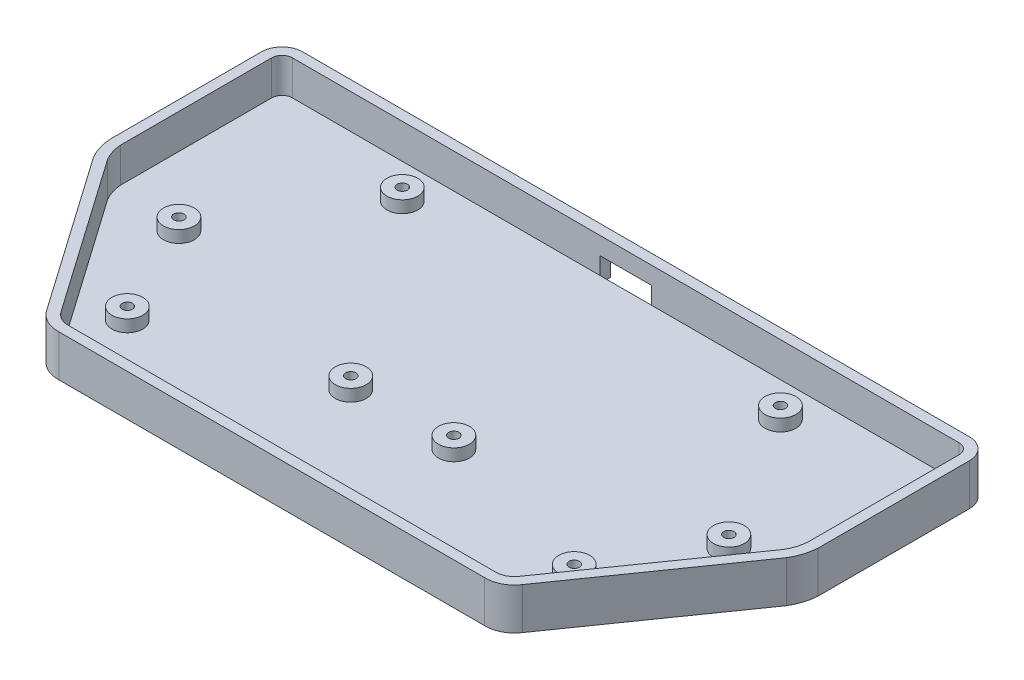
from build123d import *

# Parameters (mm, degrees)
EXTRUDE_1_DEPTH     = 2
EXTRUDE_START       = 10.1
EXTRUDE_2_DEPTH     = 10.1
SKETCH_3_R          = 1.5
CUT_EXTRUDE_1_DEPTH = 228.860936532
EXTRUDE_START_2     = 3.5
SKETCH_6_R          = 4.5
SKETCH_6_R_2        = 1.5
EXTRUDE_3_DEPTH     = 3.5
SKETCH_7_W          = 15
SKETCH_7_H          = 7
CUT_EXTRUDE_2_DEPTH = 3


with BuildPart() as part:
    # 草图1 → 凸台-拉伸1 (new body)
    with BuildSketch(Plane(origin=(0, 0, 0), x_dir=(1, 0, 0), z_dir=(0, 1, 0))):
        with BuildLine():
            Line((197, 3), (3, 3))
            ThreePointArc((3, 3), (-1.242640687, 1.242640687), (-3, -3))
            Line((-3, -3), (-3, -47.100513143))
            ThreePointArc((-3, -47.100513143), (-2.32247943, -50.732097147), (-0.794949231, -54.09573922))
            Line((-0.794949231, -54.09573922), (30.796891429, -99.226940163))
            ThreePointArc((30.796891429, -99.226940163), (33.932268231, -102.05074496), (38.04363979, -103))
            Line((38.04363979, -103), (161.95636021, -103))
            ThreePointArc((161.95636021, -103), (166.067731769, -102.05074496), (169.203108571, -99.226940163))
            Line((169.203108571, -99.226940163), (200.794949231, -54.09573922))
            ThreePointArc((200.794949231, -54.09573922), (202.32247943, -50.732097147), (203, -47.100513143))
            Line((203, -47.100513143), (203, -3))
            ThreePointArc((203, -3), (201.242640687, 1.242640687), (197, 3))
        make_face()
    extrude(amount=-EXTRUDE_1_DEPTH)

    # 草图1<3> → 凸台-拉伸2 (add)
    with BuildSketch(Plane(origin=(0, 0, 0), x_dir=(1, 0, 0), z_dir=(0, 1, 0)).offset(EXTRUDE_START)):
        with BuildLine():
            Line((197, 3), (3, 3))
            ThreePointArc((3, 3), (-1.242640687, 1.242640687), (-3, -3))
            Line((-3, -3), (-3, -47.100513143))
            ThreePointArc((-3, -47.100513143), (-2.32247943, -50.732097147), (-0.794949231, -54.09573922))
            Line((-0.794949231, -54.09573922), (30.796891429, -99.226940163))
            ThreePointArc((30.796891429, -99.226940163), (33.932268231, -102.05074496), (38.04363979, -103))
            Line((38.04363979, -103), (161.95636021, -103))
            ThreePointArc((161.95636021, -103), (166.067731769, -102.05074496), (169.203108571, -99.226940163))
            Line((169.203108571, -99.226940163), (200.794949231, -54.09573922))
            ThreePointArc((200.794949231, -54.09573922), (202.32247943, -50.732097147), (203, -47.100513143))
            Line((203, -47.100513143), (203, -3))
            ThreePointArc((203, -3), (201.242640687, 1.242640687), (197, 3))
        make_face()
        with BuildLine():
            Line((0, -3), (0, -47))
            ThreePointArc((0, -47), (0.538734236, -49.830178992), (1.720387033, -52.457695762))
            Line((1.720387033, -52.457695762), (33.279612967, -97.542304238))
            ThreePointArc((33.279612967, -97.542304238), (35.317699373, -99.389808931), (38, -100))
            Line((38, -100), (162, -100))
            ThreePointArc((162, -100), (164.682300627, -99.389808931), (166.720387033, -97.542304238))
            Line((166.720387033, -97.542304238), (198.279612967, -52.457695762))
            ThreePointArc((198.279612967, -52.457695762), (199.461265764, -49.830178992), (200, -47))
            Line((200, -47), (200, -3))
            ThreePointArc((200, -3), (199.121320344, -0.878679656), (197, 0))
            Line((197, 0), (3, 0))
            ThreePointArc((3, 0), (0.878679656, -0.878679656), (0, -3))
        make_face(mode=Mode.SUBTRACT)
    extrude(amount=-EXTRUDE_2_DEPTH)

    # 草图3 → 切除-拉伸1 (cut, through all)
    with BuildSketch(Plane(origin=(0, 0, 0), x_dir=(1, 0, 0), z_dir=(0, 1, 0))):
        with Locations((45, -10)):
            Circle(SKETCH_3_R)
        with Locations((20, -50)):
            Circle(SKETCH_3_R)
        with Locations((35, -80)):
            Circle(SKETCH_3_R)
        with Locations((85, -65)):
            Circle(SKETCH_3_R)
        with Locations((155, -10)):
            Circle(SKETCH_3_R)
        with Locations((180, -50)):
            Circle(SKETCH_3_R)
        with Locations((165, -80)):
            Circle(SKETCH_3_R)
        with Locations((115, -65)):
            Circle(SKETCH_3_R)
    extrude(amount=-CUT_EXTRUDE_1_DEPTH, mode=Mode.SUBTRACT)

    # 草图6 → 凸台-拉伸3 (add)
    # profile 1 of 8: a face of its own
    with BuildSketch(Plane(origin=(0, 0, 0), x_dir=(1, 0, 0), z_dir=(0, 1, 0)).offset(EXTRUDE_START_2)):
        with Locations((85, -65)):
            Circle(SKETCH_6_R)
        with Locations((85, -65)):
            Circle(SKETCH_6_R_2, mode=Mode.SUBTRACT)
    # profile 2 of 8: a face of its own
    with BuildSketch(Plane(origin=(0, 0, 0), x_dir=(1, 0, 0), z_dir=(0, 1, 0)).offset(EXTRUDE_START_2)):
        with Locations((35, -80)):
            Circle(SKETCH_6_R)
        with Locations((35, -80)):
            Circle(SKETCH_6_R_2, mode=Mode.SUBTRACT)
    # profile 3 of 8: a face of its own
    with BuildSketch(Plane(origin=(0, 0, 0), x_dir=(1, 0, 0), z_dir=(0, 1, 0)).offset(EXTRUDE_START_2)):
        with Locations((20, -50)):
            Circle(SKETCH_6_R)
        with Locations((20, -50)):
            Circle(SKETCH_6_R_2, mode=Mode.SUBTRACT)
    # profile 4 of 8: a face of its own
    with BuildSketch(Plane(origin=(0, 0, 0), x_dir=(1, 0, 0), z_dir=(0, 1, 0)).offset(EXTRUDE_START_2)):
        with Locations((45, -10)):
            Circle(SKETCH_6_R)
        with Locations((45, -10)):
            Circle(SKETCH_6_R_2, mode=Mode.SUBTRACT)
    # profile 5 of 8: a face of its own
    with BuildSketch(Plane(origin=(0, 0, 0), x_dir=(1, 0, 0), z_dir=(0, 1, 0)).offset(EXTRUDE_START_2)):
        with Locations((155, -10)):
            Circle(SKETCH_6_R)
        with Locations((155, -10)):
            Circle(SKETCH_6_R_2, mode=Mode.SUBTRACT)
    # profile 6 of 8: a face of its own
    with BuildSketch(Plane(origin=(0, 0, 0), x_dir=(1, 0, 0), z_dir=(0, 1, 0)).offset(EXTRUDE_START_2)):
        with Locations((115, -65)):
            Circle(SKETCH_6_R)
        with Locations((115, -65)):
            Circle(SKETCH_6_R_2, mode=Mode.SUBTRACT)
    # profile 7 of 8: a face of its own
    with BuildSketch(Plane(origin=(0, 0, 0), x_dir=(1, 0, 0), z_dir=(0, 1, 0)).offset(EXTRUDE_START_2)):
        with Locations((180, -50)):
            Circle(SKETCH_6_R)
        with Locations((180, -50)):
            Circle(SKETCH_6_R_2, mode=Mode.SUBTRACT)
    # profile 8 of 8: a face of its own
    with BuildSketch(Plane(origin=(0, 0, 0), x_dir=(1, 0, 0), z_dir=(0, 1, 0)).offset(EXTRUDE_START_2)):
        with Locations((165, -80)):
            Circle(SKETCH_6_R)
        with Locations((165, -80)):
            Circle(SKETCH_6_R_2, mode=Mode.SUBTRACT)
    extrude(amount=-EXTRUDE_3_DEPTH)

    # 草图7 → 切除-拉伸2 (cut)
    with BuildSketch(Plane(origin=(0, 0, -3), x_dir=(-1, 0, 0), z_dir=(0, 0, -1))):
        with Locations((-100, 1.5)):
            Rectangle(SKETCH_7_W, SKETCH_7_H)
    extrude(amount=-CUT_EXTRUDE_2_DEPTH, mode=Mode.SUBTRACT)


solid = part.part
